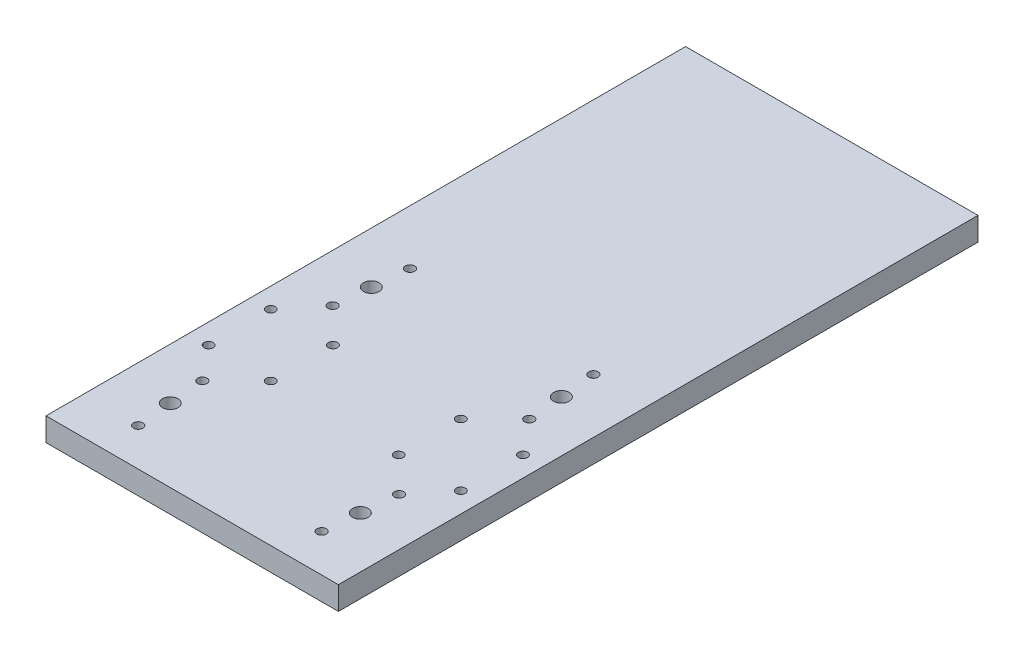
from build123d import *

# Parameters (mm, degrees)
CROQUIS1_W                = 160
CROQUIS1_H                = 350
CROQUIS1_R                = 4.25
SALIENTE_EXTRUIR1_DEPTH   = 6.35
TALADRO_ROSCADO_1_4_201_D = 5.1054
TALADRO_ROSCADO_M6X1_01_D = 5


with BuildPart() as part:
    # Croquis1 → Saliente-Extruir1 (new, symmetric)
    with BuildSketch(Plane(origin=(0, 0, 0), x_dir=(1, 0, 0), z_dir=(0, 1, 0))):
        Rectangle(CROQUIS1_W, CROQUIS1_H)
        with Locations(Location((52, -135, 0), (0, 0, 270))):
            Circle(CROQUIS1_R, mode=Mode.SUBTRACT)
        with Locations(Location((52, -25, 0), (0, 0, 90))):
            Circle(CROQUIS1_R, mode=Mode.SUBTRACT)
        with Locations(Location((-52, -135, 0), (0, 0, 90))):
            Circle(CROQUIS1_R, mode=Mode.SUBTRACT)
        with Locations(Location((-52, -25, 0), (0, 0, 270))):
            Circle(CROQUIS1_R, mode=Mode.SUBTRACT)
    extrude(amount=SALIENTE_EXTRUIR1_DEPTH, both=True)

    # Taladro roscado 1/4-201 (through all)
    with Locations(Plane(origin=(0, 6.35, 0), x_dir=(1, 0, 0), z_dir=(0, 1, 0))):
        with Locations((50.180629632, -154.364720278), (53.819370368, -115.635279722), (50.180629632, -5.635279722), (53.819370368, -44.364720278), (-53.819370368, -44.364720278), (-50.180629632, -5.635279722), (-53.819370368, -115.635279722), (-50.180629632, -154.364720278)):
            Hole(TALADRO_ROSCADO_1_4_201_D / 2)

    # Taladro roscado M6x1.01 (through all)
    with Locations(Plane(origin=(0, 6.35, 0), x_dir=(1, 0, 0), z_dir=(0, 1, 0))):
        with Locations((69, -97), (35, -63), (35, -97), (69, -63), (-69, -63), (-35, -97), (-35, -63), (-69, -97)):
            Hole(TALADRO_ROSCADO_M6X1_01_D / 2)


solid = part.part
